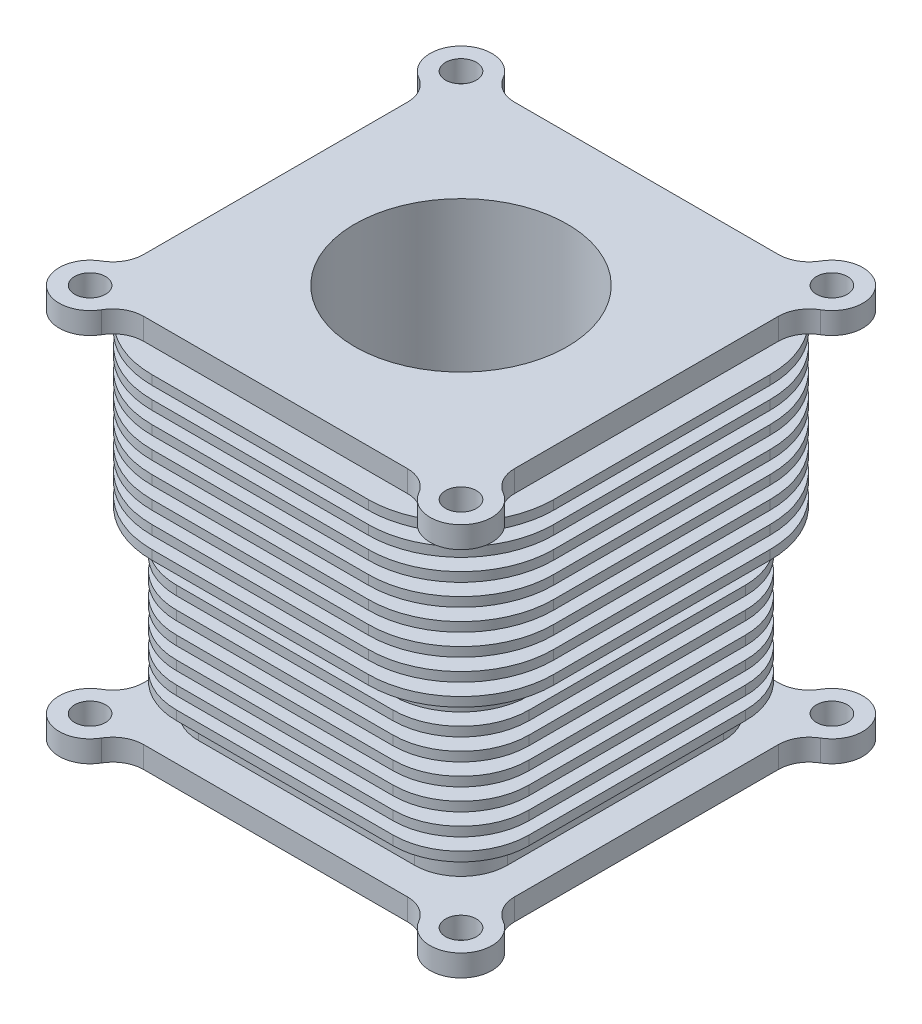
from build123d import *

# Parameters (mm, degrees)
BOSS_EXTRUDE1_DEPTH     = 8.89
FILLET1_R               = 12.7
SKETCH3_W               = 127
SKETCH3_H               = 127
BOSS_EXTRUDE2_DEPTH     = 152.4
FILLET2_R               = 19.05
BOSS_EXTRUDE4_START     = -12.7
BOSS_EXTRUDE4_DEPTH     = 3.81
LPATTERN1_COUNT         = 8
LPATTERN1_PITCH         = 8.89
FILLET1_OF_MIRROR1_R    = 12.7
BOSS_EXTRUDE5_DEPTH     = 3.81
LPATTERN2_COUNT         = 7
LPATTERN2_PITCH         = 8.89
SKETCH9_R               = 43.65625
CUT_EXTRUDE1_DEPTH      = 205.501550361
SKETCH10_R              = 6.35
CUT_EXTRUDE2_DEPTH      = 12.7
CIRPATTERN1_COUNT       = 4
MIRROR3_COPY_1_SKETCH_R = 6.35
MIRROR3_COPY_1_DEPTH    = 12.7
MIRROR3_COPY_2_SKETCH_R = 6.35
MIRROR3_COPY_2_DEPTH    = 12.7
MIRROR3_COPY_3_SKETCH_R = 6.35
MIRROR3_COPY_3_DEPTH    = 12.7
MIRROR3_COPY_4_SKETCH_R = 6.35
MIRROR3_COPY_4_DEPTH    = 12.7


with BuildPart() as part:
    # Sketch2 → Boss-Extrude1 (new body)
    with BuildSketch(Plane(origin=(0, 0, 0), x_dir=(1, 0, 0), z_dir=(0, 1, 0))):
        with BuildLine():
            Line((-63.5, 76.2), (63.5, 76.2))
            ThreePointArc((63.5, 76.2), (85.180256121, 85.180256121), (76.2, 63.5))
            Line((76.2, 63.5), (76.2, -63.5))
            ThreePointArc((76.2, -63.5), (85.180256121, -85.180256121), (63.5, -76.2))
            Line((63.5, -76.2), (-63.5, -76.2))
            ThreePointArc((-63.5, -76.2), (-85.180256121, -85.180256121), (-76.2, -63.5))
            Line((-76.2, -63.5), (-76.2, 63.5))
            ThreePointArc((-76.2, 63.5), (-85.180256121, 85.180256121), (-63.5, 76.2))
        make_face()
    boss_extrude1 = extrude(amount=BOSS_EXTRUDE1_DEPTH)

    # Fillet1
    fillet1_edges = [part.edges().sort_by_distance(p)[0] for p in [
        (-63.5, 4.445, -76.2),
        (63.5, 4.445, -76.2),
        (76.2, 4.445, -63.5),
        (-76.2, 4.445, 63.5),
        (-76.2, 4.445, -63.5),
        (76.2, 4.445, 63.5),
        (63.5, 4.445, 76.2),
        (-63.5, 4.445, 76.2),
    ]]
    fillet(fillet1_edges, radius=FILLET1_R)

    # Sketch3 → Boss-Extrude2 (add)
    with BuildSketch(Plane(origin=(0, 8.89, 0), x_dir=(1, 0, 0), z_dir=(0, 1, 0))):
        Rectangle(SKETCH3_W, SKETCH3_H)
    extrude(amount=BOSS_EXTRUDE2_DEPTH)

    # Fillet2
    fillet2_edges = [part.edges().sort_by_distance(p)[0] for p in [
        (-63.5, 85.09, 63.5),
        (-63.5, 85.09, -63.5),
        (63.5, 85.09, -63.5),
        (63.5, 85.09, 63.5),
    ]]
    fillet(fillet2_edges, radius=FILLET2_R)

    # Sketch6 → Boss-Extrude4 (add)
    with BuildSketch(Plane(origin=(0, 161.29, 0), x_dir=(1, 0, 0), z_dir=(0, 1, 0)).offset(BOSS_EXTRUDE4_START)):
        with BuildLine():
            Line((-82.55, 44.45), (-82.55, -44.45))
            ThreePointArc((-82.55, -44.45), (-71.390768363, -71.390768363), (-44.45, -82.55))
            Line((-44.45, -82.55), (44.45, -82.55))
            ThreePointArc((44.45, -82.55), (71.390768363, -71.390768363), (82.55, -44.45))
            Line((82.55, -44.45), (82.55, 44.45))
            ThreePointArc((82.55, 44.45), (71.390768363, 71.390768363), (44.45, 82.55))
            Line((44.45, 82.55), (-44.45, 82.55))
            ThreePointArc((-44.45, 82.55), (-71.390768363, 71.390768363), (-82.55, 44.45))
        make_face()
    boss_extrude4 = extrude(amount=-BOSS_EXTRUDE4_DEPTH)

    # LPattern1: Boss-Extrude4 ×8
    with Locations(*[(0, -i * LPATTERN1_PITCH, 0) for i in range(1, LPATTERN1_COUNT)]):
        add(boss_extrude4)

    # Mirror1: Boss-Extrude1 across plane
    add(boss_extrude1.mirror(Plane.ZX.offset(80.645)))

    # Fillet1 of Mirror1
    fillet1_of_mirror1_edges = [part.edges().sort_by_distance(p)[0] for p in [
        (-63.5, 156.845, -76.2),
        (63.5, 156.845, -76.2),
        (76.2, 156.845, -63.5),
        (-76.2, 156.845, 63.5),
        (-76.2, 156.845, -63.5),
        (76.2, 156.845, 63.5),
        (63.5, 156.845, 76.2),
        (-63.5, 156.845, 76.2),
    ]]
    fillet(fillet1_of_mirror1_edges, radius=FILLET1_OF_MIRROR1_R)

    # Sketch8 → Boss-Extrude5 (add)
    with BuildSketch(Plane(origin=(0, 77.47, 0), x_dir=(1, 0, 0), z_dir=(0, 1, 0))):
        with BuildLine():
            Line((72.39, -44.45), (72.39, 44.45))
            ThreePointArc((72.39, 44.45), (64.206563466, 64.206563466), (44.45, 72.39))
            Line((44.45, 72.39), (-44.45, 72.39))
            ThreePointArc((-44.45, 72.39), (-64.206563466, 64.206563466), (-72.39, 44.45))
            Line((-72.39, 44.45), (-72.39, -44.45))
            ThreePointArc((-72.39, -44.45), (-64.206563466, -64.206563466), (-44.45, -72.39))
            Line((-44.45, -72.39), (44.45, -72.39))
            ThreePointArc((44.45, -72.39), (64.206563466, -64.206563466), (72.39, -44.45))
        make_face()
        with BuildLine():
            Line((-63.5, 44.45), (-63.5, -44.45))
            ThreePointArc((-63.5, -44.45), (-57.920384182, -57.920384182), (-44.45, -63.5))
            Line((-44.45, -63.5), (44.45, -63.5))
            ThreePointArc((44.45, -63.5), (57.920384182, -57.920384182), (63.5, -44.45))
            Line((63.5, -44.45), (63.5, 44.45))
            ThreePointArc((63.5, 44.45), (57.920384182, 57.920384182), (44.45, 63.5))
            Line((44.45, 63.5), (-44.45, 63.5))
            ThreePointArc((-44.45, 63.5), (-57.920384182, 57.920384182), (-63.5, 44.45))
        make_face(mode=Mode.SUBTRACT)
    boss_extrude5 = extrude(amount=-BOSS_EXTRUDE5_DEPTH)

    # LPattern2: Boss-Extrude5 ×7
    with Locations(*[(0, -i * LPATTERN2_PITCH, 0) for i in range(1, LPATTERN2_COUNT)]):
        add(boss_extrude5)

    # Sketch9 → Cut-Extrude1 (cut, through all)
    with BuildSketch(Plane(origin=(0, 161.29, 0), x_dir=(1, 0, 0), z_dir=(0, 1, 0))):
        Circle(SKETCH9_R)
    extrude(amount=-CUT_EXTRUDE1_DEPTH, mode=Mode.SUBTRACT)

    # Sketch10 → Cut-Extrude2 (cut)
    with BuildSketch(Plane(origin=(0, 161.29, 0), x_dir=(1, 0, 0), z_dir=(0, 1, 0))):
        with Locations((-76.2, 76.2)):
            Circle(SKETCH10_R)
    cut_extrude2 = extrude(amount=-CUT_EXTRUDE2_DEPTH, mode=Mode.SUBTRACT)

    # CirPattern1: Cut-Extrude2 ×4 about axis
    cirpattern1_axis = Axis((0, 0, 0), (0, 1, 0))
    for i in range(1, CIRPATTERN1_COUNT):
        add(cut_extrude2.rotate(cirpattern1_axis, i * 360 / CIRPATTERN1_COUNT), mode=Mode.SUBTRACT)

    # Mirror3 copy 1 sketch → Mirror3 copy 1 (cut)
    with BuildSketch(Plane(origin=(0, 0, 0), x_dir=(0, 0, -1), z_dir=(0, -1, 0))):
        with Locations((-76.2, -76.2)):
            Circle(MIRROR3_COPY_1_SKETCH_R)
    extrude(amount=-MIRROR3_COPY_1_DEPTH, mode=Mode.SUBTRACT)

    # Mirror3 copy 2 sketch → Mirror3 copy 2 (cut)
    with BuildSketch(Plane(origin=(0, 0, 0), x_dir=(-1, 0, 0), z_dir=(0, -1, 0))):
        with Locations((-76.2, -76.2)):
            Circle(MIRROR3_COPY_2_SKETCH_R)
    extrude(amount=-MIRROR3_COPY_2_DEPTH, mode=Mode.SUBTRACT)

    # Mirror3 copy 3 sketch → Mirror3 copy 3 (cut)
    with BuildSketch(Plane(origin=(0, 0, 0), x_dir=(0, 0, 1), z_dir=(0, -1, 0))):
        with Locations((-76.2, -76.2)):
            Circle(MIRROR3_COPY_3_SKETCH_R)
    extrude(amount=-MIRROR3_COPY_3_DEPTH, mode=Mode.SUBTRACT)

    # Mirror3 copy 4 sketch → Mirror3 copy 4 (cut)
    with BuildSketch(Plane.XZ):
        with Locations((-76.2, -76.2)):
            Circle(MIRROR3_COPY_4_SKETCH_R)
    extrude(amount=-MIRROR3_COPY_4_DEPTH, mode=Mode.SUBTRACT)


solid = part.part
